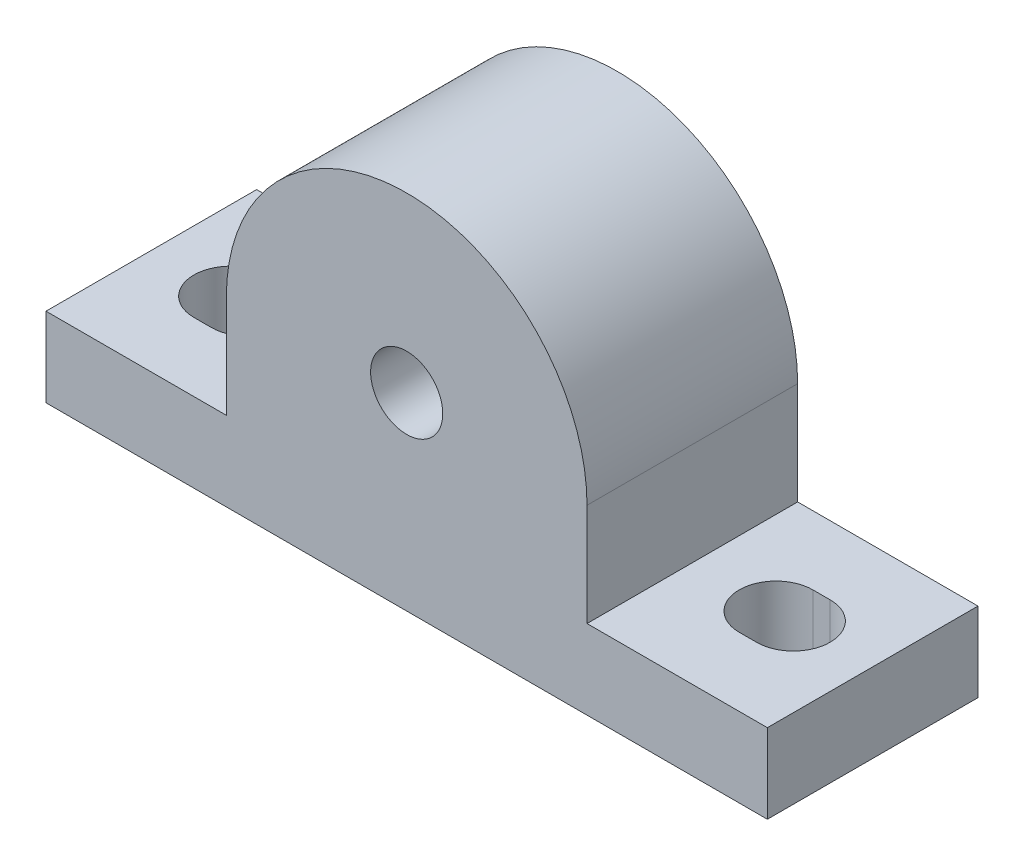
from build123d import *

# Parameters (mm, degrees)
SKETCH1_R           = 6.35
BOSS_EXTRUDE1_DEPTH = 18.542
CUT_EXTRUDE1_DEPTH  = 92.872891976


with BuildPart() as part:
    # Sketch1 → Boss-Extrude1 (new, symmetric)
    with BuildSketch(Plane.XY):
        with BuildLine():
            Line((-63.5, -33.274), (63.5, -33.274))
            Line((63.5, -33.274), (63.5, -19.304))
            Line((63.5, -19.304), (31.75, -19.304))
            Line((31.75, -19.304), (31.75, -1.27))
            ThreePointArc((31.75, -1.27), (0, 30.48), (-31.75, -1.27))
            Line((-31.75, -1.27), (-31.75, -19.304))
            Line((-31.75, -19.304), (-63.5, -19.304))
            Line((-63.5, -19.304), (-63.5, -33.274))
        make_face()
        Circle(SKETCH1_R, mode=Mode.SUBTRACT)
    extrude(amount=BOSS_EXTRUDE1_DEPTH, both=True)

    # Sketch2 → Cut-Extrude1 (cut, through all)
    with BuildSketch(Plane.XZ.offset(33.274)):
        with BuildLine():
            Line((-49.53, 6.477), (-46.482, 6.477))
            ThreePointArc((-46.482, 6.477), (-40.005, 0), (-46.482, -6.477))
            Line((-46.482, -6.477), (-49.53, -6.477))
            ThreePointArc((-49.53, -6.477), (-56.007, 0), (-49.53, 6.477))
        make_face()
        with BuildLine():
            Line((49.53, 6.477), (46.482, 6.477))
            ThreePointArc((46.482, 6.477), (40.005, 0), (46.482, -6.477))
            Line((46.482, -6.477), (49.53, -6.477))
            ThreePointArc((49.53, -6.477), (56.007, 0), (49.53, 6.477))
        make_face()
    extrude(amount=-CUT_EXTRUDE1_DEPTH, mode=Mode.SUBTRACT)


solid = part.part
